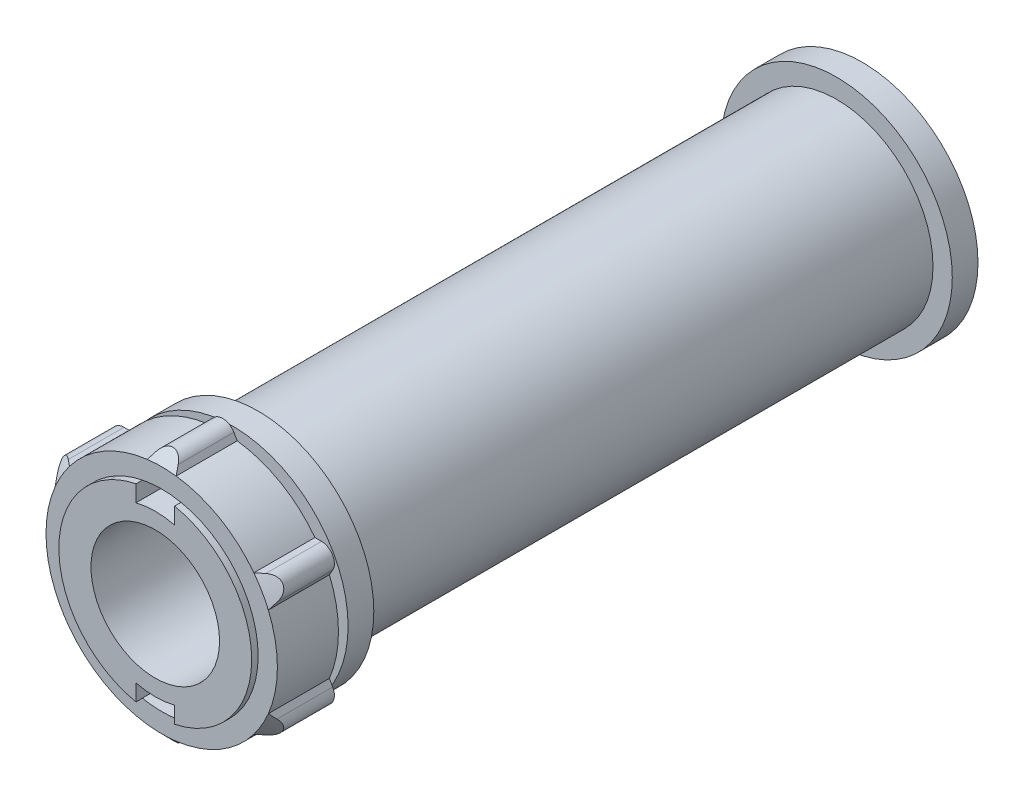
from build123d import *

# Parameters (mm, degrees)
SKETCH1_R           = 15
SKETCH1_R_2         = 13.25
BOSS_EXTRUDE1_DEPTH = 110
SKETCH2_R           = 18
SKETCH2_R_2         = 15
BOSS_EXTRUDE2_DEPTH = 4
BOSS_EXTRUDE3_START = 94
SKETCH3_R           = 18
SKETCH3_R_2         = 15
BOSS_EXTRUDE3_DEPTH = 4
BOSS_EXTRUDE4_START = -24
SKETCH4_R           = 13.25
SKETCH4_R_2         = 10
BOSS_EXTRUDE4_DEPTH = 24
CUT_EXTRUDE1_START  = -7
CUT_EXTRUDE1_DEPTH  = 7
CUT_EXTRUDE2_DEPTH  = 4
BOSS_EXTRUDE5_START = 1.5
SKETCH5_R           = 18
SKETCH5_R_2         = 15
BOSS_EXTRUDE5_DEPTH = 9.5
BOSS_EXTRUDE6_DEPTH = 9.5


with BuildPart() as part:
    # Sketch1 → Boss-Extrude1 (new body)
    with BuildSketch(Plane.XY):
        Circle(SKETCH1_R)
        Circle(SKETCH1_R_2, mode=Mode.SUBTRACT)
    extrude(amount=BOSS_EXTRUDE1_DEPTH)

    # Sketch2 → Boss-Extrude2 (add)
    with BuildSketch(Plane.XY):
        Circle(SKETCH2_R)
        Circle(SKETCH2_R_2, mode=Mode.SUBTRACT)
    extrude(amount=BOSS_EXTRUDE2_DEPTH)

    # Sketch3 → Boss-Extrude3 (add)
    with BuildSketch(Plane.XY.offset(BOSS_EXTRUDE3_START)):
        Circle(SKETCH3_R)
        Circle(SKETCH3_R_2, mode=Mode.SUBTRACT)
    extrude(amount=BOSS_EXTRUDE3_DEPTH)

    # Sketch4 → Boss-Extrude4 (add)
    with BuildSketch(Plane.XY.offset(110).offset(BOSS_EXTRUDE4_START)):
        Circle(SKETCH4_R)
        Circle(SKETCH4_R_2, mode=Mode.SUBTRACT)
    extrude(amount=BOSS_EXTRUDE4_DEPTH)

    # Sketch6 → Cut-Extrude1 (cut)
    with BuildSketch(Plane.XY.offset(110).offset(CUT_EXTRUDE1_START)):
        with BuildLine():
            Line((-3, 14.696938457), (-3, 12.1346611))
            ThreePointArc((-3, 12.1346611), (0, 12.5), (3, 12.1346611))
            Line((3, 12.1346611), (3, 14.696938457))
            ThreePointArc((3, 14.696938457), (0, 15), (-3, 14.696938457))
        make_face()
        with BuildLine():
            Line((3, -14.696938457), (3, -12.1346611))
            ThreePointArc((3, -12.1346611), (0, -12.5), (-3, -12.1346611))
            Line((-3, -12.1346611), (-3, -14.696938457))
            ThreePointArc((-3, -14.696938457), (0, -15), (3, -14.696938457))
        make_face()
    extrude(amount=CUT_EXTRUDE1_DEPTH, mode=Mode.SUBTRACT)

    # Sketch7 → Cut-Extrude2 (cut)
    with BuildSketch(Plane.XY.offset(103)):
        with BuildLine():
            Line((3, 14.696938457), (3, 12.1346611))
            ThreePointArc((3, 12.1346611), (12.306877399, 2.188782466), (7, -10.356157589))
            Line((7, -10.356157589), (7, -13.266499161))
            ThreePointArc((7, -13.266499161), (14.848853857, 2.124038405), (3, 14.696938457))
        make_face()
        with BuildLine():
            Line((-3, -14.696938457), (-3, -12.1346611))
            ThreePointArc((-3, -12.1346611), (-12.306877399, -2.188782466), (-7, 10.356157589))
            Line((-7, 10.356157589), (-7, 13.266499161))
            ThreePointArc((-7, 13.266499161), (-14.848853857, -2.124038405), (-3, -14.696938457))
        make_face()
    extrude(amount=CUT_EXTRUDE2_DEPTH, mode=Mode.SUBTRACT)


with BuildPart() as body_2:
    # Sketch5 → Boss-Extrude5 (new body)
    with BuildSketch(Plane.XY.offset(98).offset(BOSS_EXTRUDE5_START)):
        Circle(SKETCH5_R)
        Circle(SKETCH5_R_2, mode=Mode.SUBTRACT)
    extrude(amount=BOSS_EXTRUDE5_DEPTH)

    # Sketch8 → Boss-Extrude6 (add)
    with BuildSketch(Plane(origin=(0, 0, 99.5), x_dir=(-1, 0, 0), z_dir=(0, 0, -1))):
        with BuildLine():
            Line((-2.250000007, 17.858821349), (-1.737190938, 18.747032699))
            ThreePointArc((-1.737190938, 18.747032699), (-4e-09, 19.75), (1.737190934, 18.747032706))
            Line((1.737190934, 18.747032706), (2.249999993, 17.858821351))
            ThreePointArc((2.249999993, 17.858821351), (-7e-09, 18), (-2.250000007, 17.858821349))
        make_face()
        with BuildLine():
            Line((14.341192967, 10.877967839), (15.366811094, 10.877967833))
            ThreePointArc((15.366811094, 10.877967833), (17.104001723, 9.875000003), (17.104002036, 7.869064873))
            Line((17.104002036, 7.869064873), (16.591192968, 6.980853522))
            ThreePointArc((16.591192968, 6.980853522), (15.588457265, 9.000000006), (14.341192967, 10.877967839))
        make_face()
        with BuildLine():
            Line((16.591192973, -6.98085351), (17.104002032, -7.869064866))
            ThreePointArc((17.104002032, -7.869064866), (17.104001727, -9.874999997), (15.366811102, -10.877967833))
            Line((15.366811102, -10.877967833), (14.341192974, -10.877967828))
            ThreePointArc((14.341192974, -10.877967828), (15.588457271, -8.999999994), (16.591192973, -6.98085351))
        make_face()
        with BuildLine():
            Line((2.250000007, -17.858821349), (1.737190938, -18.747032699))
            ThreePointArc((1.737190938, -18.747032699), (4e-09, -19.75), (-1.737190934, -18.747032706))
            Line((-1.737190934, -18.747032706), (-2.249999993, -17.858821351))
            ThreePointArc((-2.249999993, -17.858821351), (7e-09, -18), (2.250000007, -17.858821349))
        make_face()
        with BuildLine():
            Line((-14.341192967, -10.877967839), (-15.366811094, -10.877967833))
            ThreePointArc((-15.366811094, -10.877967833), (-17.104001723, -9.875000003), (-17.104002036, -7.869064873))
            Line((-17.104002036, -7.869064873), (-16.591192968, -6.980853522))
            ThreePointArc((-16.591192968, -6.980853522), (-15.588457265, -9.000000006), (-14.341192967, -10.877967839))
        make_face()
        with BuildLine():
            Line((-16.591192973, 6.98085351), (-17.104002032, 7.869064866))
            ThreePointArc((-17.104002032, 7.869064866), (-17.104001727, 9.874999997), (-15.366811102, 10.877967833))
            Line((-15.366811102, 10.877967833), (-14.341192974, 10.877967828))
            ThreePointArc((-14.341192974, 10.877967828), (-15.588457271, 8.999999994), (-16.591192973, 6.98085351))
        make_face()
    extrude(amount=-BOSS_EXTRUDE6_DEPTH)

    # Sketch10 → Cut-Revolve1 (revolve, cut)
    with BuildSketch(Plane(origin=(0, 0, 0), x_dir=(0, 0, -1), z_dir=(1, 0, 0)), mode=Mode.PRIVATE) as cut_revolve1_sk:
        Polygon((-109, 19.75), (-109, 18), (-107.25, 19.75), align=None)
    revolve(cut_revolve1_sk.sketch.rotate(Axis((0, 0, 109), (0, 0, -1)), 332.181860715), axis=Axis((0, 0, 109), (0, 0, -1)), mode=Mode.SUBTRACT)


solid = Compound([part.part, body_2.part])
